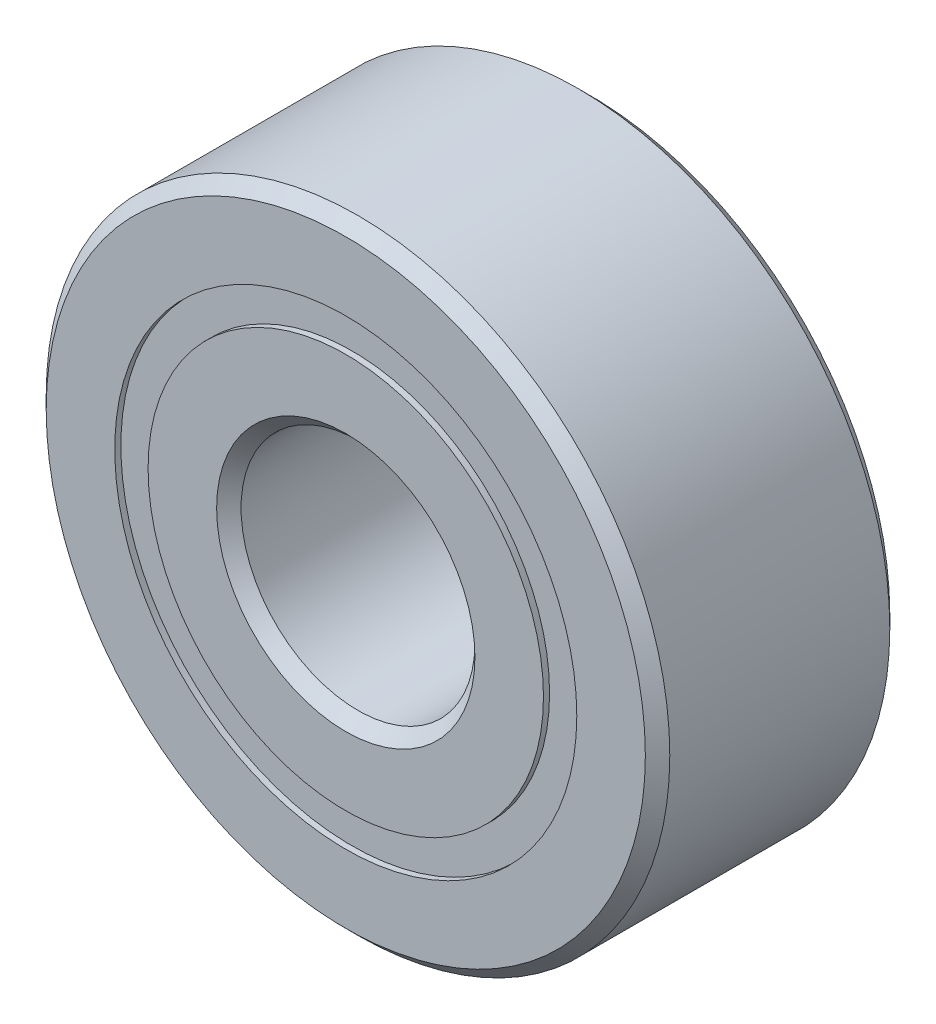
from build123d import *

# Parameters (mm, degrees)
CIRPATTERN1_COUNT = 8
SKETCH5_W         = 1.207534705
SKETCH5_H         = 0.678821978


with BuildPart() as part:
    # Sketch1 → Revolve1 (revolve)
    with BuildSketch(Plane(origin=(0, 0, 0), x_dir=(0, 0, -1), z_dir=(1, 0, 0))):
        with BuildLine():
            Line((2.24028, 6.35), (-2.24028, 6.35))
            Line((-2.24028, 6.35), (-2.4892, 6.10108))
            Line((-2.4892, 6.10108), (-2.4892, 4.705035989))
            Line((-2.4892, 4.705035989), (-1.106311111, 4.705035989))
            ThreePointArc((-1.106311111, 4.705035989), (0, 5.522830295), (1.106311111, 4.705035989))
            Line((1.106311111, 4.705035989), (2.4892, 4.705035989))
            Line((2.4892, 4.705035989), (2.4892, 6.10108))
            Line((2.4892, 6.10108), (2.24028, 6.35))
        make_face()
    revolve(axis=Axis((0, 0, 2.4892), (0, 0, -1)))


with BuildPart() as body_2:
    # Sketch3 → Revolve3 (revolve)
    with BuildSketch(Plane(origin=(0, 0, 0), x_dir=(0, 0, -1), z_dir=(1, 0, 0))):
        with BuildLine():
            Line((-2.4892, 4.026214011), (-1.106311111, 4.026214011))
            ThreePointArc((-1.106311111, 4.026214011), (0, 3.208419705), (1.106311111, 4.026214011))
            Line((1.106311111, 4.026214011), (2.4892, 4.026214011))
            Line((2.4892, 4.026214011), (2.4892, 2.63017))
            Line((2.4892, 2.63017), (2.24028, 2.38125))
            Line((2.24028, 2.38125), (-2.24028, 2.38125))
            Line((-2.24028, 2.38125), (-2.4892, 2.63017))
            Line((-2.4892, 2.63017), (-2.4892, 4.026214011))
        make_face()
    revolve(axis=Axis((0, 0, 2.4892), (0, 0, -1)))


with BuildPart() as body_3:
    # Sketch4 → Revolve4 (revolve)
    with BuildSketch(Plane(origin=(0, 0, 0), x_dir=(0, 0, -1), z_dir=(1, 0, 0))):
        with BuildLine():
            Line((-1.157205295, 4.365625), (1.157205295, 4.365625))
            ThreePointArc((1.157205295, 4.365625), (0, 5.522830295), (-1.157205295, 4.365625))
        make_face()
    revolve(axis=Axis((0, 4.365625, 1.157205295), (0, 0, -1)))


with BuildPart() as cirpattern1_1:
    # CirPattern1: pattern copy
    add(body_3.part.rotate(Axis((0, 0, -2.4892), (0, 0, 1)), 1 * 360 / CIRPATTERN1_COUNT))


with BuildPart() as cirpattern1_2:
    # CirPattern1: pattern copy
    add(body_3.part.rotate(Axis((0, 0, -2.4892), (0, 0, 1)), 2 * 360 / CIRPATTERN1_COUNT))


with BuildPart() as cirpattern1_3:
    # CirPattern1: pattern copy
    add(body_3.part.rotate(Axis((0, 0, -2.4892), (0, 0, 1)), 3 * 360 / CIRPATTERN1_COUNT))


with BuildPart() as cirpattern1_4:
    # CirPattern1: pattern copy
    add(body_3.part.rotate(Axis((0, 0, -2.4892), (0, 0, 1)), 4 * 360 / CIRPATTERN1_COUNT))


with BuildPart() as cirpattern1_5:
    # CirPattern1: pattern copy
    add(body_3.part.rotate(Axis((0, 0, -2.4892), (0, 0, 1)), 5 * 360 / CIRPATTERN1_COUNT))


with BuildPart() as cirpattern1_6:
    # CirPattern1: pattern copy
    add(body_3.part.rotate(Axis((0, 0, -2.4892), (0, 0, 1)), 6 * 360 / CIRPATTERN1_COUNT))


with BuildPart() as cirpattern1_7:
    # CirPattern1: pattern copy
    add(body_3.part.rotate(Axis((0, 0, -2.4892), (0, 0, 1)), 7 * 360 / CIRPATTERN1_COUNT))


with BuildPart() as body_11:
    # Sketch5 → Revolve5 (revolve)
    with BuildSketch(Plane(origin=(0, 0, 0), x_dir=(0, 0, -1), z_dir=(1, 0, 0))):
        with Locations((-1.760972648, 4.365625)):
            Rectangle(SKETCH5_W, SKETCH5_H)
        with Locations((1.760972648, 4.365625)):
            Rectangle(SKETCH5_W, SKETCH5_H)
    revolve(axis=Axis((0, 0, 2.4892), (0, 0, -1)))


solid = Compound([part.part, body_2.part, body_3.part, cirpattern1_1.part, cirpattern1_2.part, cirpattern1_3.part, cirpattern1_4.part, cirpattern1_5.part, cirpattern1_6.part, cirpattern1_7.part, body_11.part])
